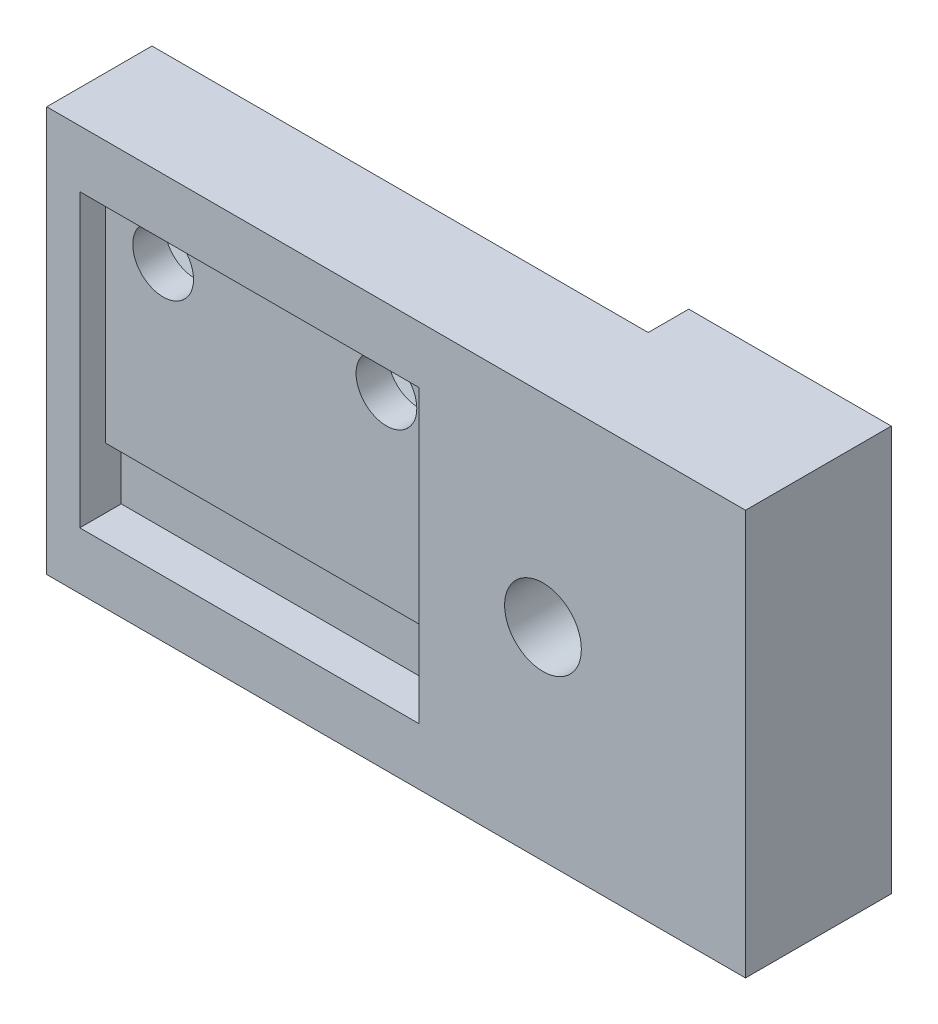
from build123d import *
from build123d.topology import SkipClean

# Parameters (mm, degrees)
SKETCH1_W           = 43.815
SKETCH1_H           = 25.4
SKETCH1_R           = 1.9039967
SKETCH1_R_2         = 2.40665
BOSS_EXTRUDE1_DEPTH = 2
SKETCH2_W           = 43.815
SKETCH2_H           = 25.4
SKETCH2_R           = 2.40665
SKETCH2_W_2         = 21.254
SKETCH2_H_2         = 18.254
BOSS_EXTRUDE2_DEPTH = 1.6
BOSS_EXTRUDE3_START = 3
SKETCH3_W           = 43.815
SKETCH3_H           = 25.4
SKETCH3_R           = 2.40665
BOSS_EXTRUDE3_DEPTH = 3
BOSS_EXTRUDE4_DEPTH = 2.54
SKETCH5_W           = 21.254
SKETCH5_H           = 3.81
CUT_EXTRUDE1_DEPTH  = 1


with BuildPart() as part:
    # Sketch1 → Boss-Extrude1 (new body)
    with BuildSketch(Plane.XY):
        with Locations((21.9075, 12.7)):
            Rectangle(SKETCH1_W, SKETCH1_H)
        with Locations((5.7, 19.026000048)):
            Circle(SKETCH1_R, mode=Mode.SUBTRACT)
        with Locations((19.7, 19.026000048)):
            Circle(SKETCH1_R, mode=Mode.SUBTRACT)
        with Locations((31.115, 12.7)):
            Circle(SKETCH1_R_2, mode=Mode.SUBTRACT)
    extrude(amount=BOSS_EXTRUDE1_DEPTH)

    # Sketch2 → Boss-Extrude2 (add)
    with BuildSketch(Plane.XY.offset(2)):
        with Locations((21.9075, 12.7)):
            Rectangle(SKETCH2_W, SKETCH2_H)
        with Locations((31.115, 12.7)):
            Circle(SKETCH2_R, mode=Mode.SUBTRACT)
        with Locations((12.7, 12.7)):
            Rectangle(SKETCH2_W_2, SKETCH2_H_2, mode=Mode.SUBTRACT)
    extrude(amount=BOSS_EXTRUDE2_DEPTH)

    # Sketch3 → Boss-Extrude3 (add)
    with SkipClean():  # the faces are left unmerged after this step: merging them gives an invalid solid
        with BuildSketch(Plane(origin=(0, 0, 0), x_dir=(-1, 0, 0), z_dir=(0, 0, -1)).offset(BOSS_EXTRUDE3_START)):
            with Locations((-21.9075, 12.7)):
                Rectangle(SKETCH3_W, SKETCH3_H)
            with Locations((-31.115, 12.7)):
                Circle(SKETCH3_R, mode=Mode.SUBTRACT)
            Polygon((-16.5690055, 17.218319531), (-16.5690055, 20.833680565), (-19.7, 22.641361083), (-22.8309945, 20.833680565), (-22.8309945, 17.218319531), (-19.7, 15.410639013), align=None, mode=Mode.SUBTRACT)
            Polygon((-2.5690055, 20.833680565), (-5.7, 22.641361083), (-8.8309945, 20.833680565), (-8.8309945, 17.218319531), (-5.7, 15.410639013), (-2.5690055, 17.218319531), align=None, mode=Mode.SUBTRACT)
        extrude(amount=-BOSS_EXTRUDE3_DEPTH)

    # Sketch4 → Boss-Extrude4 (add)
    with SkipClean():  # the faces are left unmerged after this step: merging them gives an invalid solid
        with BuildSketch(Plane(origin=(0, 0, -3), x_dir=(-1, 0, 0), z_dir=(0, 0, -1))):
            with BuildLine():
                Line((-31.115, 25.4), (-31.115, 21.717))
                Line((-31.115, 21.717), (-32.615185644, 21.717))
                ThreePointArc((-32.615185644, 21.717), (-37.930376048, 19.515376048), (-40.132, 14.200185644))
                Line((-40.132, 14.200185644), (-40.132, 11.199814356))
                ThreePointArc((-40.132, 11.199814356), (-37.930376048, 5.884623952), (-32.615185644, 3.683))
                Line((-32.615185644, 3.683), (-31.115, 3.683))
                Line((-31.115, 3.683), (-31.115, 0))
                Line((-31.115, 0), (-43.815, 0))
                Line((-43.815, 0), (-43.815, 25.4))
                Line((-43.815, 25.4), (-31.115, 25.4))
            make_face()
        extrude(amount=BOSS_EXTRUDE4_DEPTH)

    # Sketch5 → Cut-Extrude1 (cut)
    with SkipClean():  # the faces are left unmerged after this step: merging them gives an invalid solid
        with BuildSketch(Plane.XY.offset(2)):
            with Locations((12.7, 5.478)):
                Rectangle(SKETCH5_W, SKETCH5_H)
        extrude(amount=-CUT_EXTRUDE1_DEPTH, mode=Mode.SUBTRACT)


solid = part.part
